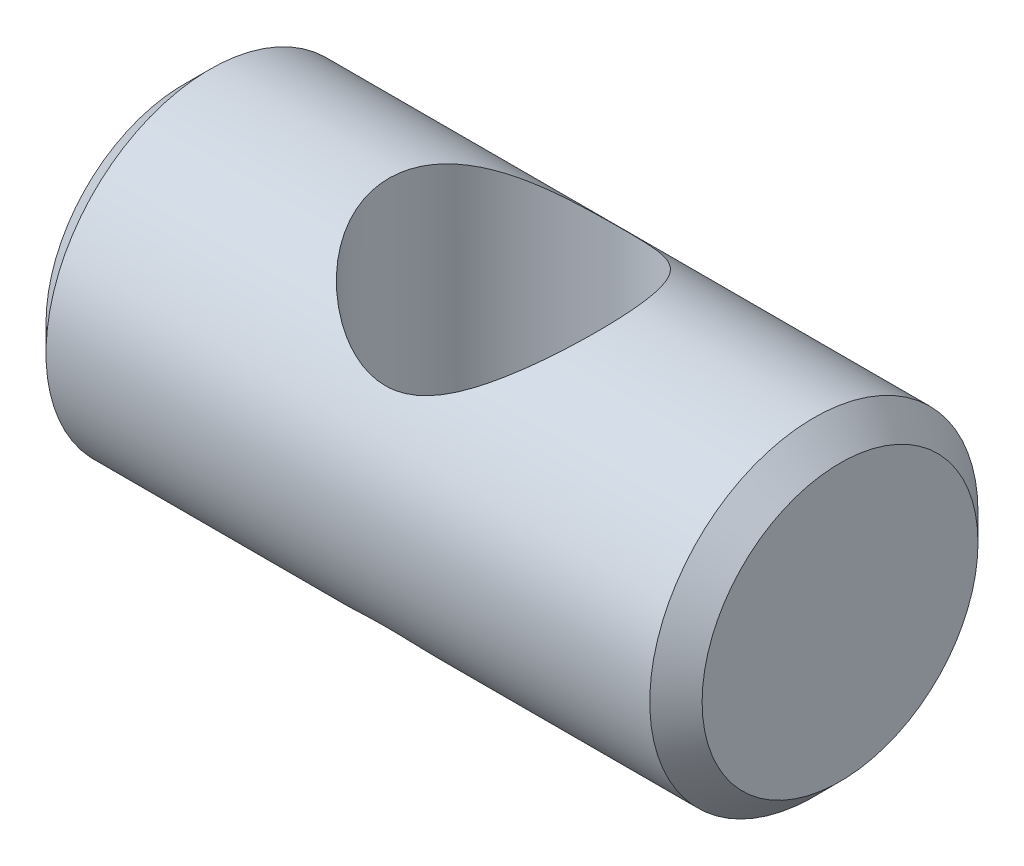
from build123d import *

# Parameters (mm, degrees)
SKETCH2_R           = 4.765
BOSS_EXTRUDE1_DEPTH = 9.525
CHAMFER1_SIZE       = 0.76
SKETCH3_R           = 3.43
CUT_EXTRUDE1_DEPTH  = 9.525


with BuildPart() as part:
    # Sketch2 → Boss-Extrude1 (new, symmetric)
    with BuildSketch(Plane(origin=(0, 0, 0), x_dir=(0, 0, -1), z_dir=(1, 0, 0))):
        with Locations(Location((0, 0, 0), (0, 0, 180))):
            Circle(SKETCH2_R)
    extrude(amount=BOSS_EXTRUDE1_DEPTH, both=True)

    # Chamfer1
    chamfer1_edges = [part.edges().sort_by_distance(p)[0] for p in [
        (-9.525, 0, -4.765),
        (9.525, 0, -4.765),
    ]]
    chamfer(chamfer1_edges, length=CHAMFER1_SIZE)

    # Sketch3 → Cut-Extrude1 (cut, symmetric)
    with BuildSketch(Plane(origin=(0, 0, 0), x_dir=(1, 0, 0), z_dir=(0, 1, 0))):
        with Locations(Location((0, -0.25, 0), (0, 0, 270))):
            Circle(SKETCH3_R)
    extrude(amount=CUT_EXTRUDE1_DEPTH, both=True, mode=Mode.SUBTRACT)


solid = part.part
